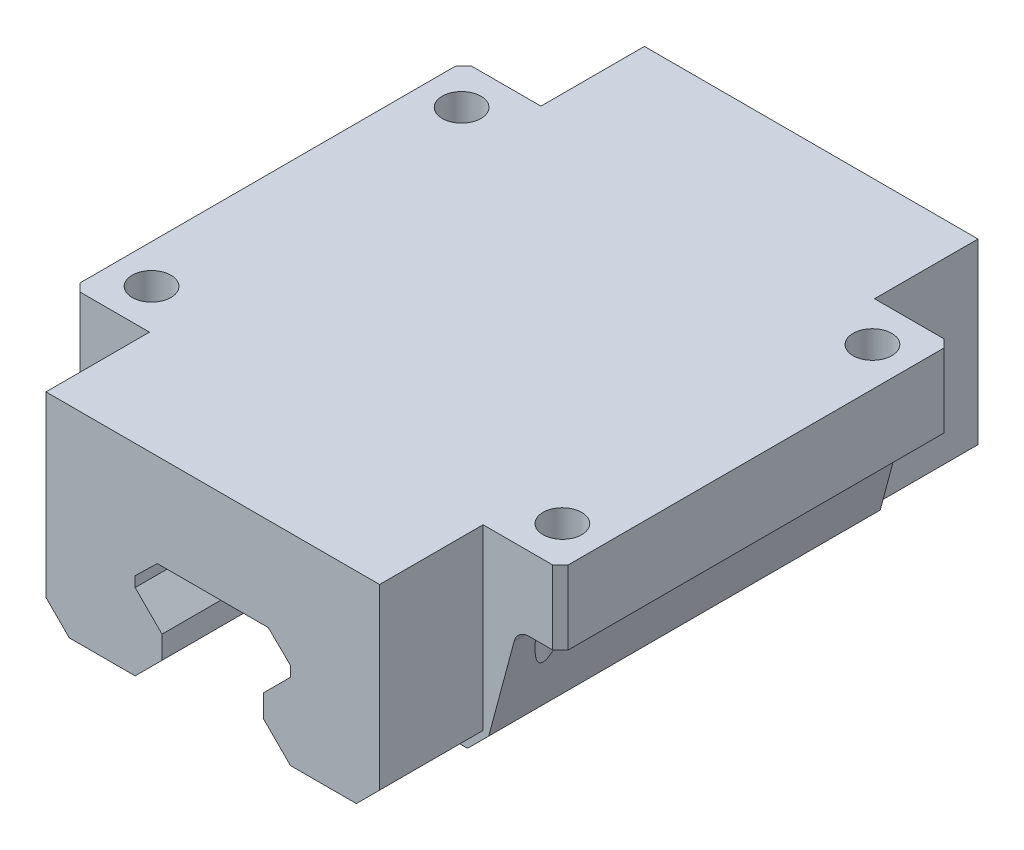
from build123d import *
from OCP.BRepFilletAPI import BRepFilletAPI_MakeChamfer

# Parameters (mm, degrees)
BOSS_EXTRUDE1_DEPTH       = 38.6
BOSS_EXTRUDE1_DEPTH_BACK  = 38.6
BOSS_EXTRUDE2_DEPTH       = 25.25
BOSS_EXTRUDE2_DEPTH_BACK  = 25.25
CHAMFER1_SIZE             = 3
CHAMFER2_SIZE             = 2
CHAMFER2_SIZE2            = 2.828427125
FILLET1_R                 = 2
M6X1_0_TAPPED_HOLE1_D     = 5
M6X1_0_TAPPED_HOLE1_DEPTH = 25.981766235
M6X1_0_TAPPED_HOLE1_TIP   = 1.502151548
CHAMFER3_SIZE             = 1


with BuildPart() as part:
    # Sketch3 → Boss-Extrude1 (new, two sides: drawn at the far end of the back side and taken through both)
    with BuildSketch(Plane.XY.offset(-BOSS_EXTRUDE1_DEPTH_BACK)):
        Polygon((-21.518233765, 4.018233765), (-10.018233765, 4.018233765), (-6.55, 7.48646753), (-6.55, 10.41646753), (-10.018233765, 13.884701295), (-10.018233765, 15.214701295), (-7.16, 18), (7.16, 18), (10.018233765, 15.214701295), (10.018233765, 13.884701295), (6.55, 10.41646753), (6.55, 7.48646753), (10.018233765, 4.018233765), (21.518233765, 4.018233765), (21.518233765, 30), (-21.518233765, 30), align=None)
    extrude(amount=BOSS_EXTRUDE1_DEPTH + BOSS_EXTRUDE1_DEPTH_BACK)

    # Sketch3<4> → Boss-Extrude2 (add, two sides: drawn at the far end of the back side and taken through both)
    with BuildSketch(Plane.XY.offset(-BOSS_EXTRUDE2_DEPTH_BACK)):
        Polygon((-25.934509717, 20.5), (-21.518233765, 4.018233765), (-21.518233765, 30), (-31.5, 30), (-31.5, 20.5), align=None)
        Polygon((21.518233765, 30), (21.518233765, 4.018233765), (25.934509717, 20.5), (31.5, 20.5), (31.5, 30), align=None)
    extrude(amount=BOSS_EXTRUDE2_DEPTH + BOSS_EXTRUDE2_DEPTH_BACK)

    # Chamfer1
    chamfer1_edges = [part.edges().sort_by_distance(p)[0] for p in [
        (-21.518233765, 4.018233765, 31.925),
        (21.518233765, 4.018233765, 31.925),
        (21.518233765, 4.018233765, -31.925),
        (-21.518233765, 4.018233765, -31.925),
    ]]
    chamfer(chamfer1_edges, length=CHAMFER1_SIZE)

    # Chamfer2: one chamfer whose edges measure the first distance from different faces: ONE call of the kernel's chamfer builder (chamfer() names one face for all edges)
    chamfer2_edges_1 = [part.edges().sort_by_distance(p)[0] for p in [
        (21.518233765, 4.018233765, 0),
    ]]
    chamfer2_side_1 = [part.faces().sort_by_distance(p)[0] for p in [
        (15.346759208, 4.018233765, 0),
    ]]
    chamfer2_edges_2 = [part.edges().sort_by_distance(p)[0] for p in [
        (-21.518233765, 4.018233765, 0),
    ]]
    chamfer2_side_2 = [part.faces().sort_by_distance(p)[0] for p in [
        (-15.346759208, 4.018233765, 0),
    ]]
    chamfer2 = BRepFilletAPI_MakeChamfer(part.part.solid().wrapped)
    for e in chamfer2_edges_1:
        chamfer2.Add(CHAMFER2_SIZE, CHAMFER2_SIZE2, e.wrapped, chamfer2_side_1[0].wrapped)  # the first distance lies on this face
    for e in chamfer2_edges_2:
        chamfer2.Add(CHAMFER2_SIZE, CHAMFER2_SIZE2, e.wrapped, chamfer2_side_2[0].wrapped)  # the first distance lies on this face
    add(Compound.cast(chamfer2.Shape()), mode=Mode.REPLACE)

    # Fillet1
    fillet1_edges = [part.edges().sort_by_distance(p)[0] for p in [
        (-25.934509717, 20.5, 0),
        (25.934509717, 20.5, 0),
    ]]
    fillet(fillet1_edges, radius=FILLET1_R)

    # M6x1.0 Tapped Hole1
    with Locations(Plane(origin=(-26.5, 30, 20), x_dir=(0, 0, 1), z_dir=(0, 1, 0))):
        with Locations((0, 0), (-40, 0), (-40, 53), (0, 53)):
            Hole(M6X1_0_TAPPED_HOLE1_D / 2, depth=M6X1_0_TAPPED_HOLE1_DEPTH)
            with Locations((0, 0, -(M6X1_0_TAPPED_HOLE1_DEPTH + M6X1_0_TAPPED_HOLE1_TIP / 2))):  # 118° drill point
                Cone(0, M6X1_0_TAPPED_HOLE1_D / 2, M6X1_0_TAPPED_HOLE1_TIP, mode=Mode.SUBTRACT)

    # Chamfer3
    chamfer3_edges = [part.edges().sort_by_distance(p)[0] for p in [
        (-31.5, 25.25, 25.25),
        (31.5, 25.25, 25.25),
        (31.5, 25.25, -25.25),
        (-31.5, 25.25, -25.25),
    ]]
    chamfer(chamfer3_edges, length=CHAMFER3_SIZE)


solid = part.part
